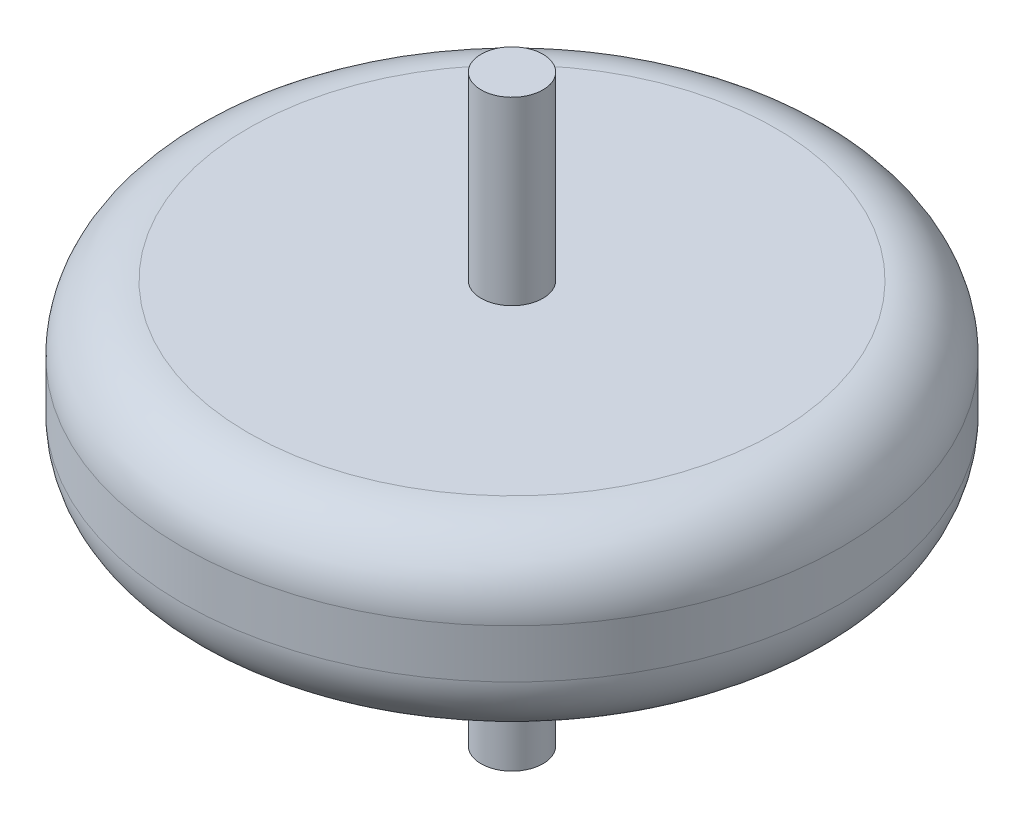
from build123d import *

# Parameters (mm, degrees)
SKETCH1_R                = 101.6
BOSS_EXTRUDE1_DEPTH      = 27.813
BOSS_EXTRUDE2_DEPTH      = 55.626
BOSS_EXTRUDE2_DEPTH_BACK = 124.206
SKETCH2_R                = 9.525
FILLET1_R                = 20.32


with BuildPart() as part:
    # Sketch1 → Boss-Extrude1 (new, symmetric)
    with BuildSketch(Plane(origin=(0, 0, 0), x_dir=(1, 0, 0), z_dir=(0, 1, 0))):
        with Locations(Location((0, 0, 0), (0, 0, 270))):
            Circle(SKETCH1_R)
    extrude(amount=BOSS_EXTRUDE1_DEPTH, both=True)

    # Sketch2 → Boss-Extrude2 (add, two sides: drawn at the far end of the back side and taken through both)
    with BuildSketch(Plane(origin=(0, 27.813, 0), x_dir=(1, 0, 0), z_dir=(0, 1, 0)).offset(-BOSS_EXTRUDE2_DEPTH_BACK)):
        with Locations(Location((0, 0, 0), (0, 0, 270))):
            Circle(SKETCH2_R)
    extrude(amount=BOSS_EXTRUDE2_DEPTH + BOSS_EXTRUDE2_DEPTH_BACK)

    # Fillet1
    fillet1_edges = [part.edges().sort_by_distance(p)[0] for p in [
        (0, -27.813, -101.6),
        (0, 27.813, -101.6),
    ]]
    fillet(fillet1_edges, radius=FILLET1_R)


solid = part.part
